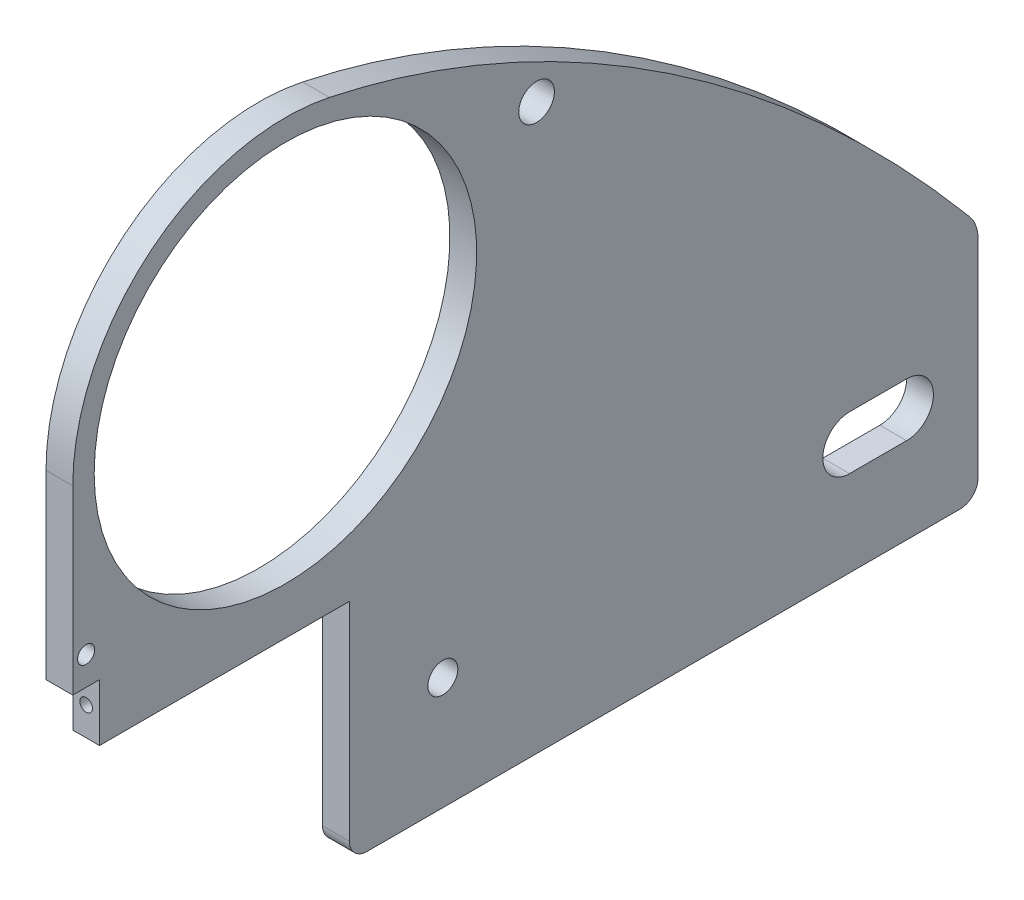
from build123d import *

# Parameters (mm, degrees)
SKETCH1_R           = 1.524
SKETCH1_R_2         = 3.175
SKETCH1_R_3         = 2.667
SKETCH1_R_4         = 34.04
BOSS_EXTRUDE1_DEPTH = 4.7625
SKETCH2_R           = 1.1303
CUT_EXTRUDE1_DEPTH  = 6.35


with BuildPart() as part:
    # Sketch1 → Boss-Extrude1 (new body)
    with BuildSketch(Plane(origin=(0, 0, 0), x_dir=(0, 0, -1), z_dir=(1, 0, 0))):
        with BuildLine():
            Line((-28.170295117, 0), (77.382795117, 0))
            ThreePointArc((77.382795117, 0), (79.627859148, 0.92993597), (80.557795117, 3.175))
            Line((80.557795117, 3.175), (80.557795117, 40.132))
            ThreePointArc((80.557795117, 40.132), (80.175158576, 42.302961389), (79.073362565, 44.212288398))
            add(Edge.make_bspline(
                [(-34.867281509, 119.579027078), (-0.058341562, 112.208593965), (41.263784204, 89.298575374), (79.073362565, 44.212288398)],
                knots=[0, 0, 0, 0, 1, 1, 1, 1], degree=3))
            ThreePointArc((-34.867281509, 119.579027078), (-66.539067219, 111.95566221), (-80.557795117, 82.55))
            Line((-80.557795117, 82.55), (-80.557795117, 50.292))
            Line((-80.557795117, 50.292), (-75.795295117, 50.292))
            Line((-75.795295117, 50.292), (-75.795295117, 40.132))
            Line((-75.795295117, 40.132), (-31.345295117, 40.132))
            Line((-31.345295117, 40.132), (-31.345295117, 3.175))
            ThreePointArc((-31.345295117, 3.175), (-30.415359148, 0.92993597), (-28.170295117, 0))
        make_face()
        with Locations(Location((-78.176545117, 55.372, 0), (0, 0, 180))):
            Circle(SKETCH1_R, mode=Mode.SUBTRACT)
        with Locations(Location((1.992204883, 100.457, 0), (0, 0, 180))):
            Circle(SKETCH1_R_2, mode=Mode.SUBTRACT)
        with Locations(Location((-14.692204883, 20.066, 0), (0, 0, 180))):
            Circle(SKETCH1_R_3, mode=Mode.SUBTRACT)
        with Locations(Location((-42.707795117, 82.55, 0), (0, 0, 180))):
            Circle(SKETCH1_R_4, mode=Mode.SUBTRACT)
        with BuildLine():
            Line((67.857795117, 15.3035), (57.697795117, 15.3035))
            ThreePointArc((57.697795117, 15.3035), (52.935295117, 20.066), (57.697795117, 24.8285))
            Line((57.697795117, 24.8285), (67.857795117, 24.8285))
            ThreePointArc((67.857795117, 24.8285), (72.620295117, 20.066), (67.857795117, 15.3035))
        make_face(mode=Mode.SUBTRACT)
    extrude(amount=BOSS_EXTRUDE1_DEPTH)

    # Sketch2 → Cut-Extrude1 (cut)
    with BuildSketch(Plane.XY.offset(75.795295117)):
        with Locations((2.38125, 45.212)):
            Circle(SKETCH2_R)
    extrude(amount=-CUT_EXTRUDE1_DEPTH, mode=Mode.SUBTRACT)


solid = part.part
